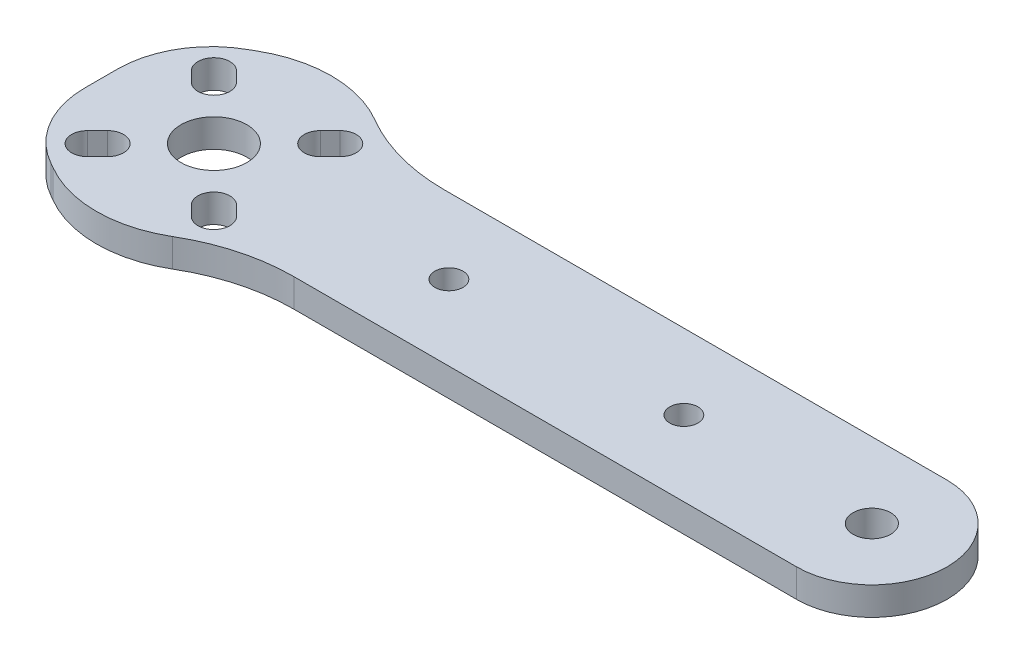
from build123d import *

# Parameters (mm, degrees)
EXTRUDE_1_DEPTH     = 3
SKETCH_8_R          = 12.5
EXTRUDE_2_DEPTH     = 3
SKETCH_2_R          = 3.5
CUT_EXTRUDE_1_DEPTH = 159.522080481
SKETCH_5_R          = 1.5
CUT_EXTRUDE_2_DEPTH = 159.522080481
FILLET_3_R          = 20
SKETCH_9_R          = 2
CUT_EXTRUDE_3_DEPTH = 159.522080481
SKETCH_12_W         = 86.588173056
SKETCH_12_H         = 26.208680734
CUT_EXTRUDE_4_DEPTH = 159.522080481
FILLET_4_R          = 10
SKETCH_13_R         = 1.5
CUT_EXTRUDE_5_DEPTH = 159.522080481


with BuildPart() as part:
    # 草图1 → 凸台-拉伸1 (new body)
    with BuildSketch(Plane(origin=(0, 0, 0), x_dir=(1, 0, 0), z_dir=(0, 1, 0))):
        with BuildLine():
            Line((0, 8), (150, 8))
            ThreePointArc((150, 8), (158, 0), (150, -8))
            Line((150, -8), (0, -8))
            ThreePointArc((0, -8), (-8, 0), (0, 8))
        make_face()
    extrude(amount=EXTRUDE_1_DEPTH)

    # 草图8 → 凸台-拉伸2 (add)
    with BuildSketch(Plane(origin=(0, 3, 0), x_dir=(1, 0, 0), z_dir=(0, 1, 0))):
        with Locations((80, 0)):
            Circle(SKETCH_8_R)
    extrude(amount=-EXTRUDE_2_DEPTH)

    # 草图2 → 切除-拉伸1 (cut, through all)
    with BuildSketch(Plane(origin=(0, 3, 0), x_dir=(1, 0, 0), z_dir=(0, 1, 0))):
        with Locations(Location((80, 0, 0), (0, 0, 270))):
            Circle(SKETCH_2_R)
        with BuildLine():
            Line((84.456249475, 6.857459024), (85.516909647, 7.918119195))
            ThreePointArc((85.516909647, 7.918119195), (87.918119195, 7.918119195), (87.918119195, 5.516909647))
            Line((87.918119195, 5.516909647), (86.857459024, 4.456249475))
            ThreePointArc((86.857459024, 4.456249475), (84.456249475, 4.456249475), (84.456249475, 6.857459024))
        make_face()
        with BuildLine():
            Line((84.456249475, -6.857459024), (85.516909647, -7.918119195))
            ThreePointArc((85.516909647, -7.918119195), (87.918119195, -7.918119195), (87.918119195, -5.516909647))
            Line((87.918119195, -5.516909647), (86.857459024, -4.456249475))
            ThreePointArc((86.857459024, -4.456249475), (84.456249475, -4.456249475), (84.456249475, -6.857459024))
        make_face()
        with BuildLine():
            Line((73.142540976, -4.456249475), (72.081880805, -5.516909647))
            ThreePointArc((72.081880805, -5.516909647), (72.081880805, -7.918119195), (74.483090353, -7.918119195))
            Line((74.483090353, -7.918119195), (75.543750525, -6.857459024))
            ThreePointArc((75.543750525, -6.857459024), (75.543750525, -4.456249475), (73.142540976, -4.456249475))
        make_face()
        with BuildLine():
            Line((75.543750525, 6.857459024), (74.483090353, 7.918119195))
            ThreePointArc((74.483090353, 7.918119195), (72.081880805, 7.918119195), (72.081880805, 5.516909647))
            Line((72.081880805, 5.516909647), (73.142540976, 4.456249475))
            ThreePointArc((73.142540976, 4.456249475), (75.543750525, 4.456249475), (75.543750525, 6.857459024))
        make_face()
    extrude(amount=-CUT_EXTRUDE_1_DEPTH, mode=Mode.SUBTRACT)

    # 草图5 → 切除-拉伸2 (cut, through all)
    with BuildSketch(Plane(origin=(0, 3, 0), x_dir=(1, 0, 0), z_dir=(0, 1, 0))):
        with Locations(Location((10, 0, 0), (0, 0, 270))):
            Circle(SKETCH_5_R)
        with Locations(Location((0, 5, 0), (0, 0, 270))):
            Circle(SKETCH_5_R)
        with Locations(Location((0, -5, 0), (0, 0, 270))):
            Circle(SKETCH_5_R)
    extrude(amount=-CUT_EXTRUDE_2_DEPTH, mode=Mode.SUBTRACT)

    # 圆角3
    fillet_3_edges = [part.edges().sort_by_distance(p)[0] for p in [
        (70.395313644, 1.5, 8),
        (70.395313644, 1.5, -8),
        (89.604686356, 1.5, 8),
        (89.604686356, 1.5, -8),
    ]]
    fillet(fillet_3_edges, radius=FILLET_3_R)

    # 草图9 → 切除-拉伸3 (cut, through all)
    with BuildSketch(Plane(origin=(0, 3, 0), x_dir=(1, 0, 0), z_dir=(0, 1, 0))):
        with Locations(Location((150, 0, 0), (0, 0, 270))):
            Circle(SKETCH_9_R)
    extrude(amount=-CUT_EXTRUDE_3_DEPTH, mode=Mode.SUBTRACT)

    # 草图12 → 切除-拉伸4 (cut, through all)
    with BuildSketch(Plane(origin=(0, 3, 0), x_dir=(1, 0, 0), z_dir=(0, 1, 0))):
        with Locations((24.705913472, 0)):
            Rectangle(SKETCH_12_W, SKETCH_12_H)
    extrude(amount=-CUT_EXTRUDE_4_DEPTH, mode=Mode.SUBTRACT)

    # 圆角4
    fillet_4_edges = [part.edges().sort_by_distance(p)[0] for p in [
        (68, 1.5, -8.51282473),
        (68, 1.5, 8.51282473),
    ]]
    fillet(fillet_4_edges, radius=FILLET_4_R)

    # 草图13 → 切除-拉伸5 (cut, through all)
    with BuildSketch(Plane(origin=(0, 3, 0), x_dir=(1, 0, 0), z_dir=(0, 1, 0))):
        with Locations(Location((105, 0, 0), (0, 0, 270))):
            Circle(SKETCH_13_R)
        with Locations(Location((130, 0, 0), (0, 0, 270))):
            Circle(SKETCH_13_R)
    extrude(amount=-CUT_EXTRUDE_5_DEPTH, mode=Mode.SUBTRACT)


solid = part.part
